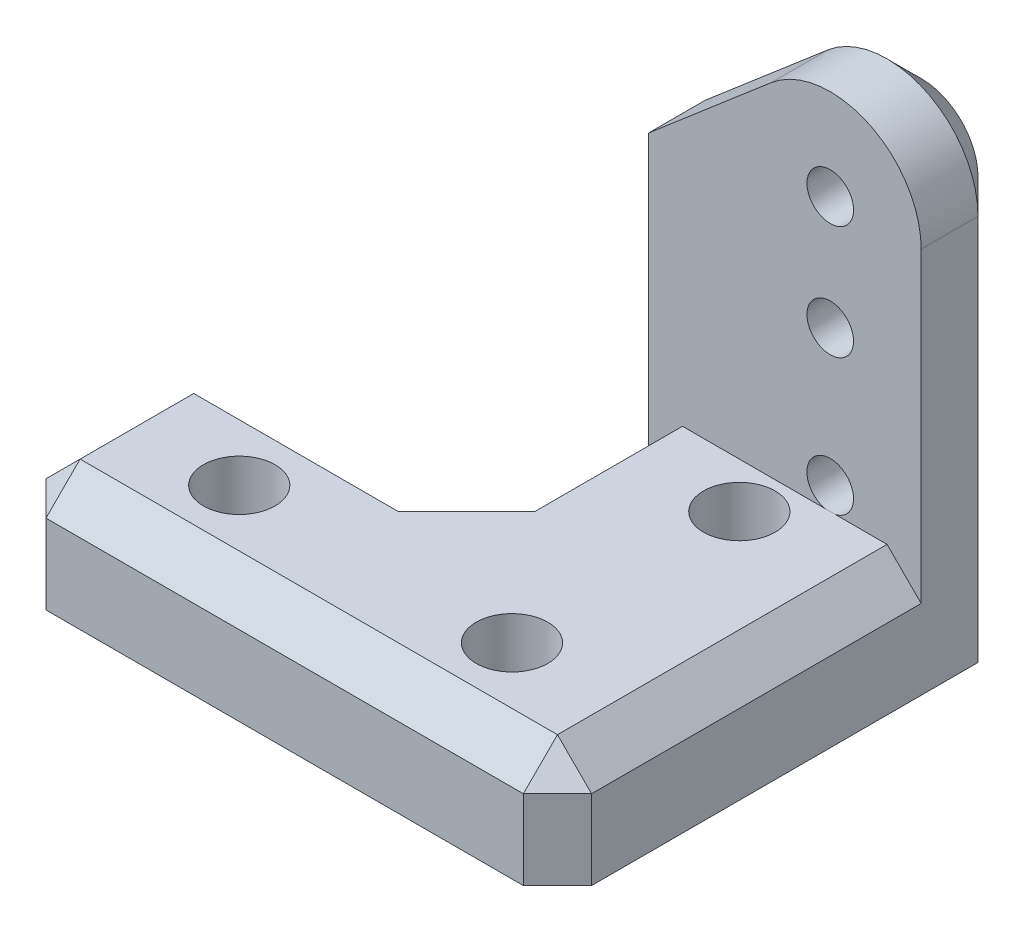
from build123d import *

# Parameters (mm, degrees)
RESSALTO_EXTRUS_O1_DEPTH                      = 20
ESBO_O2_W                                     = 16
ESBO_O2_H                                     = 16
CORTE_EXTRUS_O1_DEPTH                         = 34.120990323
FURO_ROSCADO_DE_M2_51_D                       = 2.05
FURO_ROSCADO_DE_M2_51_DEPTH                   = 7.25
FURO_ROSCADO_DE_M2_51_TIP                     = 0.615882135
CORTE_EXTRUS_O2_DEPTH                         = 34.120990323
ESBO_O9_W                                     = 8
ESBO_O9_H                                     = 5
RESSALTO_EXTRUS_O2_DEPTH                      = 12
CHANFRO1_SIZE                                 = 1.5
CHANFRO2_SIZE                                 = 1.5
FURO_ROSCADO_PARA_CONDU_TE_DE_M3X0_51_D       = 3.15
BROCA_DE_ROSQUEAR_PARA_TARRAXA_DE_M2_51_D     = 2.05
BROCA_DE_ROSQUEAR_PARA_TARRAXA_DE_M2_51_DEPTH = 4


with BuildPart() as part:
    # Esboço1 → Ressalto-extrusão1 (new body)
    with BuildSketch(Plane.XY):
        with BuildLine():
            Line((0, 0), (0, 12))
            Line((0, 12), (9.400080843, 20.039805977))
            ThreePointArc((9.400080843, 20.039805977), (13.673368365, 20.633158174), (16, 17))
            Line((16, 17), (16, 4))
            Line((16, 4), (16, 0))
            Line((16, 0), (0, 0))
        make_face()
    extrude(amount=RESSALTO_EXTRUS_O1_DEPTH)

    # Esboço2 → Corte-extrusão1 (cut, through all)
    with BuildSketch(Plane.ZY):
        with Locations((12, 13)):
            Rectangle(ESBO_O2_W, ESBO_O2_H)
    extrude(amount=-CORTE_EXTRUS_O1_DEPTH, mode=Mode.SUBTRACT)

    # Furo roscado de M2.51
    with Locations(Plane(origin=(12, 17, 4), x_dir=(1, 0, 0), z_dir=(0, 0, 1))):
        with Locations((0, 0)):
            Hole(FURO_ROSCADO_DE_M2_51_D / 2, depth=FURO_ROSCADO_DE_M2_51_DEPTH)
            with Locations((0, 0, -(FURO_ROSCADO_DE_M2_51_DEPTH + FURO_ROSCADO_DE_M2_51_TIP / 2))):  # 118° drill point
                Cone(0, FURO_ROSCADO_DE_M2_51_D / 2, FURO_ROSCADO_DE_M2_51_TIP, mode=Mode.SUBTRACT)

    # Esboço6 → Corte-extrusão2 (cut, through all)
    with BuildSketch(Plane.XY.offset(20)):
        Polygon((0, 0), (4, 0), (4, 15.42116461), (0, 12), align=None)
    extrude(amount=-CORTE_EXTRUS_O2_DEPTH, mode=Mode.SUBTRACT)

    # Esboço9 → Ressalto-extrusão2 (add)
    with BuildSketch(Plane.ZY.offset(-4)):
        with Locations((16, 2.5)):
            Rectangle(ESBO_O9_W, ESBO_O9_H)
    extrude(amount=RESSALTO_EXTRUS_O2_DEPTH)

    # Chanfro1
    chanfro1_edges = [part.edges().sort_by_distance(p)[0] for p in [
        (4, 7.710582305, 0),
        (6.700040421, 17.730485293, 0),
        (13.673368365, 20.633158174, 0),
        (16, 8.5, 0),
    ]]
    chamfer(chanfro1_edges, length=CHANFRO1_SIZE)

    # Chanfro2
    chanfro2_edges = [part.edges().sort_by_distance(p)[0] for p in [
        (16, 5, 12),
        (4, 5, 20),
        (4, 5, 8),
        (4, 2.5, 12),
        (-2, 5, 12),
        (-8, 2.5, 20),
        (-8, 5, 16),
        (-8, 2.5, 12),
        (16, 2.5, 20),
    ]]
    chamfer(chanfro2_edges, length=CHANFRO2_SIZE)

    # Furo roscado para conduíte de M3x0.51 (through all)
    with Locations(Plane(origin=(10, 0, 6), x_dir=(0, 0, -1), z_dir=(0, -1, 0))):
        with Locations((0, 0), (-10, 0), (-10, -12)):
            Hole(FURO_ROSCADO_PARA_CONDU_TE_DE_M3X0_51_D / 2)

    # Broca de rosquear para tarraxa de M2.51
    with Locations(Plane(origin=(12, 6, 0), x_dir=(-1, 0, 0), z_dir=(0, 0, -1))):
        with Locations((0, 0), (0, 6)):
            Hole(BROCA_DE_ROSQUEAR_PARA_TARRAXA_DE_M2_51_D / 2, depth=BROCA_DE_ROSQUEAR_PARA_TARRAXA_DE_M2_51_DEPTH)


solid = part.part
